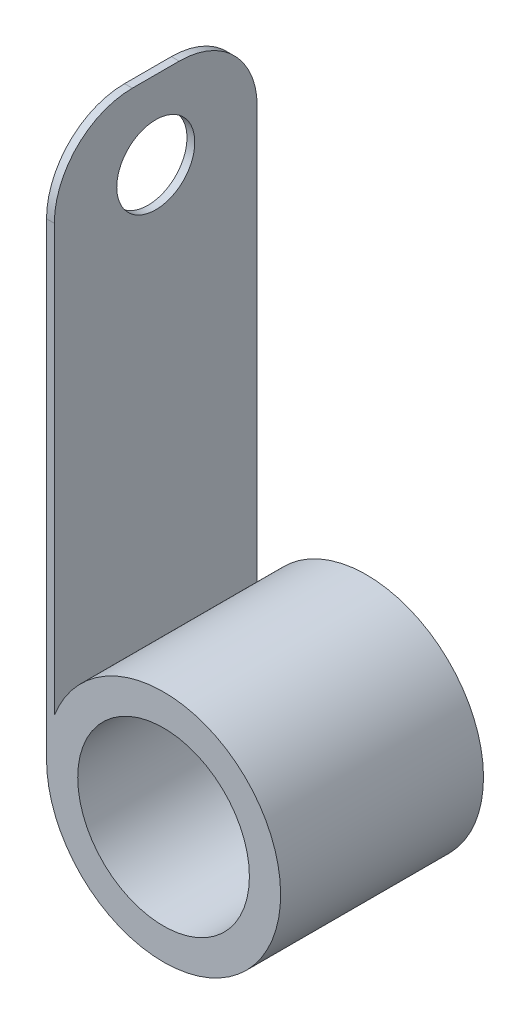
from build123d import *

# Parameters (mm, degrees)
ESBO_O1_R                = 7.5
ESBO_O1_R_2              = 5.5
RESSALTO_EXTRUS_O1_DEPTH = 13
ESBO_O2_W                = 0.5
ESBO_O2_H                = 13
RESSALTO_EXTRUS_O2_DEPTH = 35
ESBO_O3_R                = 2.5
CORTE_EXTRUS_O1_DEPTH    = 20
FILETE1_R                = 5


with BuildPart() as part:
    # Esboço1 → Ressalto-extrusão1 (new body)
    with BuildSketch(Plane.XY):
        with Locations(Location((0, 0, 0), (0, 0, 180))):
            Circle(ESBO_O1_R)
        with Locations(Location((0, 0, 0), (0, 0, 180))):
            Circle(ESBO_O1_R_2, mode=Mode.SUBTRACT)
    extrude(amount=RESSALTO_EXTRUS_O1_DEPTH)

    # Esboço2 → Ressalto-extrusão2 (add)
    with BuildSketch(Plane(origin=(0, 0, 0), x_dir=(1, 0, 0), z_dir=(0, 1, 0))):
        with Locations((-7.25, -6.5)):
            Rectangle(ESBO_O2_W, ESBO_O2_H)
    extrude(amount=RESSALTO_EXTRUS_O2_DEPTH)

    # Esboço3 → Corte-extrusão1 (cut)
    with BuildSketch(Plane.ZY.offset(7.5)):
        with Locations((6.5, 30)):
            Circle(ESBO_O3_R)
    extrude(amount=-CORTE_EXTRUS_O1_DEPTH, mode=Mode.SUBTRACT)

    # Filete1
    filete1_edges = [part.edges().sort_by_distance(p)[0] for p in [
        (-7.25, 35, 13),
        (-7.25, 35, 0),
    ]]
    fillet(filete1_edges, radius=FILETE1_R)


solid = part.part
